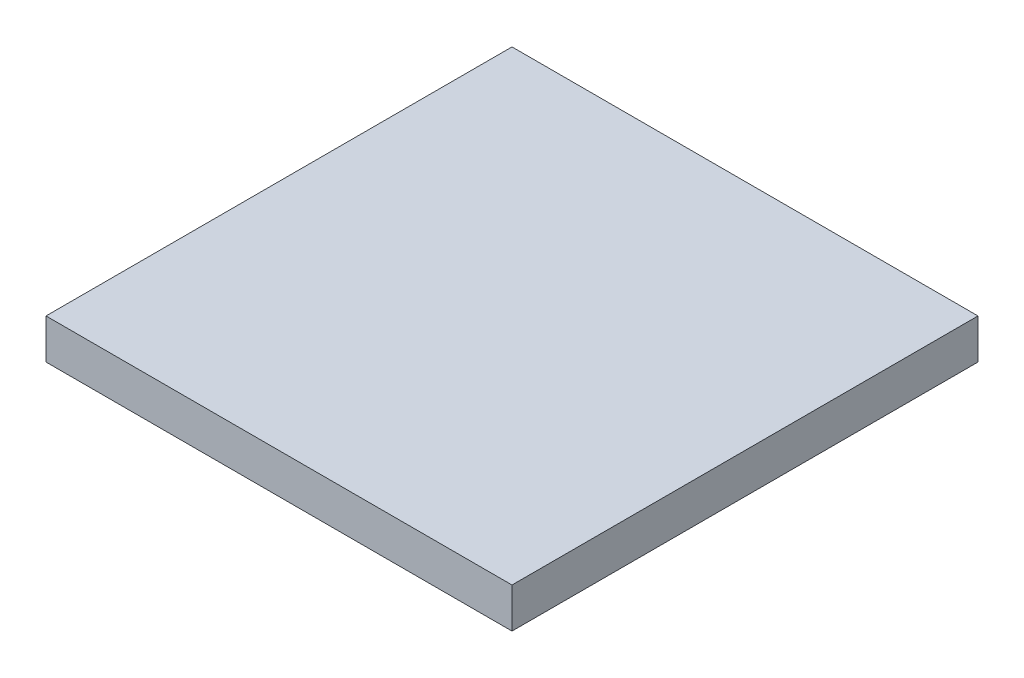
from build123d import *

# Parameters (mm, degrees)
SKETCH1_W           = 14
SKETCH1_H           = 14
BOSS_EXTRUDE1_DEPTH = 1.2


with BuildPart() as part:
    # Sketch1 → Boss-Extrude1 (new body)
    with BuildSketch(Plane(origin=(0, 0, 0), x_dir=(1, 0, 0), z_dir=(0, 1, 0))):
        with Locations((-51.809619002, -21.210899829)):
            Rectangle(SKETCH1_W, SKETCH1_H)
    extrude(amount=BOSS_EXTRUDE1_DEPTH)


solid = part.part
